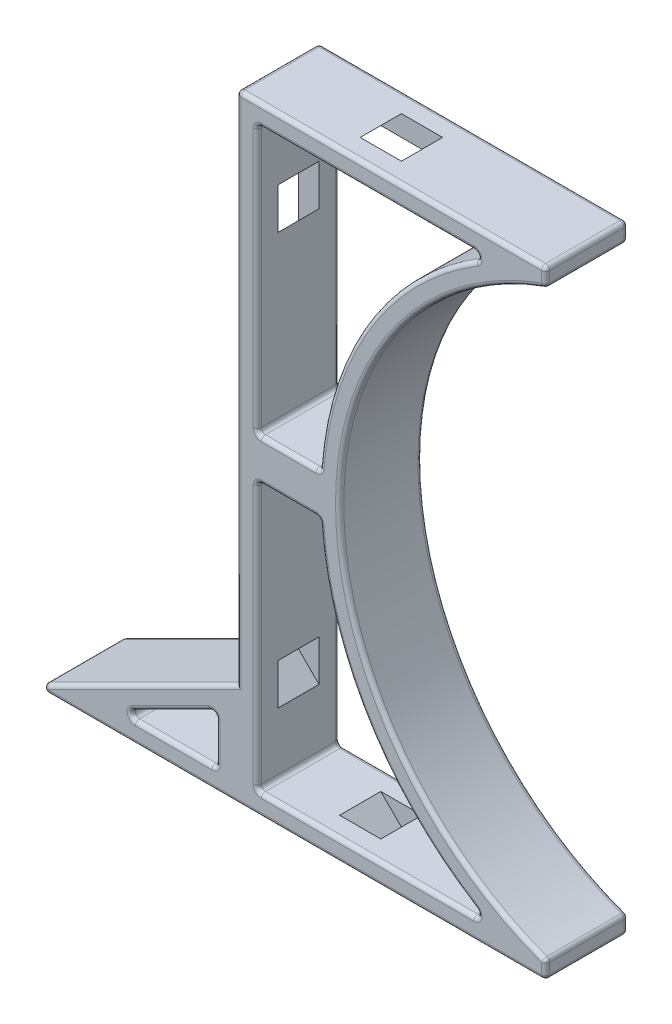
from build123d import *

# Parameters (mm, degrees)
BOSS_EXTRUDE1_DEPTH  = 2.54
CUT_EXTRUDE2_DEPTH   = 1.27
MIRROR3_COPY_1_DEPTH = 2.54
MIRROR3_COPY_2_DEPTH = 1.27
BOSS_EXTRUDE2_START  = -5.08
BOSS_EXTRUDE2_DEPTH  = 5.08
FILLET1_R            = 0.254
FILLET2_R            = 0.254


with BuildPart() as part:
    # Sketch1 → Boss-Extrude1 (new body)
    with BuildSketch(Plane.XY):
        with BuildLine():
            Line((-6.35, 19.050000000000004), (-25.4, 19.05))
            Line((-25.4, 19.05), (-25.399999999999995, 0))
            Line((-25.399999999999995, 0), (-19.049999999999997, 0))
            ThreePointArc((-19.049999999999997, 0), (-15.554259866673185, 10.998522628062371), (-6.35, 17.960512242138304))
            Line((-6.35, 17.960512242138304), (-6.35, 19.050000000000004))
        make_face()
        with BuildLine():
            Line((-24.129999999999995, 17.78), (-24.129999999999992, 1.27))
            Line((-24.129999999999992, 1.27), (-20.280273666792567, 1.27))
            ThreePointArc((-20.280273666792567, 1.27), (-17.173038634830498, 10.862280793950196), (-9.837377699366836, 17.780000000000005))
            Line((-9.837377699366836, 17.780000000000005), (-24.129999999999995, 17.78))
        make_face(mode=Mode.SUBTRACT)
    boss_extrude1 = extrude(amount=-BOSS_EXTRUDE1_DEPTH)

    # Mirror1: Boss-Extrude1 across plane
    add(boss_extrude1.mirror(Plane.ZX))

    # Sketch2 → Cut-Extrude2 (cut)
    with BuildSketch(Plane(origin=(0, 0, -2.54), x_dir=(-1, 0, 0), z_dir=(0, 0, -1))):
        Polygon((25.400000000000002, 10.159999999999998), (16.50999999999999, 19.050000000000004), (19.049999999999994, 19.050000000000004), (25.4, 12.700000000000001), align=None)
    cut_extrude2 = extrude(amount=-CUT_EXTRUDE2_DEPTH, mode=Mode.SUBTRACT)

    # Mirror2: Cut-Extrude2 across plane
    add(cut_extrude2.mirror(Plane.ZX), mode=Mode.SUBTRACT)

    # Mirror3: Boss-Extrude1, Cut-Extrude2 across plane
    add(boss_extrude1.mirror(Plane(origin=(-2.602e-14, 1.735e-14, -2.54), x_dir=(1, 0, 0), z_dir=(0, 0, -1))))
    add(cut_extrude2.mirror(Plane(origin=(-2.602e-14, 1.735e-14, -2.54), x_dir=(1, 0, 0), z_dir=(0, 0, -1))), mode=Mode.SUBTRACT)

    # Mirror3 copy 1 sketch → Mirror3 copy 1 (add)
    with BuildSketch(Plane(origin=(0, 0, -5.08), x_dir=(1, 0, 0), z_dir=(0, 0, -1))):
        with BuildLine():
            Line((-6.35, 19.050000000000004), (-25.4, 19.05))
            Line((-25.4, 19.05), (-25.399999999999995, 0))
            Line((-25.399999999999995, 0), (-19.049999999999997, 0))
            ThreePointArc((-19.049999999999997, 0), (-15.554259866673185, 10.998522628062371), (-6.35, 17.960512242138304))
            Line((-6.35, 17.960512242138304), (-6.35, 19.050000000000004))
        make_face()
        with BuildLine():
            Line((-24.129999999999995, 17.78), (-24.129999999999992, 1.27))
            Line((-24.129999999999992, 1.27), (-20.280273666792567, 1.27))
            ThreePointArc((-20.280273666792567, 1.27), (-17.173038634830498, 10.862280793950196), (-9.837377699366836, 17.780000000000005))
            Line((-9.837377699366836, 17.780000000000005), (-24.129999999999995, 17.78))
        make_face(mode=Mode.SUBTRACT)
    extrude(amount=-MIRROR3_COPY_1_DEPTH)

    # Mirror3 copy 2 sketch → Mirror3 copy 2 (cut)
    with BuildSketch(Plane(origin=(0, 0, -2.54), x_dir=(-1, 0, 0), z_dir=(0, 0, 1))):
        Polygon((25.400000000000002, 10.159999999999998), (16.50999999999999, 19.050000000000004), (19.049999999999994, 19.050000000000004), (25.4, 12.700000000000001), align=None)
    extrude(amount=-MIRROR3_COPY_2_DEPTH, mode=Mode.SUBTRACT)

    # Sketch4 → Boss-Extrude2 (add)
    with BuildSketch(Plane(origin=(0, 0, -5.08), x_dir=(-1, 0, 0), z_dir=(0, 0, -1)).offset(BOSS_EXTRUDE2_START)):
        Polygon((25.4, -19.05), (38.099999999999994, -19.05), (25.4, -12.700000000000001), align=None)
        Polygon((26.669999999999998, -17.78), (32.72019366857526, -17.78), (26.669999999999998, -14.754903165712367), align=None, mode=Mode.SUBTRACT)
    extrude(amount=BOSS_EXTRUDE2_DEPTH)

    # Fillet1
    fillet1_edges = [part.edges().sort_by_distance(p)[0] for p in [
        (-24.129999999999995, 17.78, -2.54),
        (-9.837377699366836, 17.780000000000005, -2.54),
        (-20.280273666792567, 1.27, -2.54),
        (-24.129999999999992, 1.27, -2.54),
        (-38.099999999999994, -19.05, -2.54),
        (-26.669999999999998, -17.78, -2.54),
        (-32.72019366857526, -17.78, -2.54),
        (-26.669999999999998, -14.754903165712367, -2.54),
        (-6.35, -17.960512242138307, -2.54),
        (-6.35, -19.050000000000004, -2.54),
        (-24.129999999999995, -17.78, -2.54),
        (-24.129999999999992, -1.27, -2.54),
        (-20.280273666792567, -1.27, -2.54),
        (-9.837377699366836, -17.780000000000005, -2.54),
        (-6.35, 17.960512242138307, -2.54),
        (-25.4, 19.05, -2.54),
        (-6.35, 19.050000000000004, -2.54),
    ]]
    fillet(fillet1_edges, radius=FILLET1_R)

    # Fillet2
    fillet2_edges = [part.edges().sort_by_distance(p)[0] for p in [
        (-31.268815493486017, -15.634407746743012, 0),
        (-15.875, 19.05, -5.08),
        (-15.875, 19.05, 0),
        (-24.129999999999995, 9.525, 0),
        (-17.32615367264149, 17.78, 0),
        (-17.35691828606442, 10.565973102884694, 0),
        (-22.196738957591226, 1.27, 0),
        (-6.35, 18.46761410424942, 0),
        (-25.4, 3.0479999999999983, 0),
        (-21.814019366857522, -19.050000000000004, 0),
        (-6.35, -18.4676141042494, 0),
        (-19.049999999999997, 1.332e-14, 0),
        (-17.32615367264149, -17.78, 0),
        (-24.129999999999995, -9.525, 0),
        (-22.196738957591226, -1.27, 0),
        (-17.35691828606442, -10.565973102884694, 0),
        (-29.28411620114516, -17.78, 0),
        (-29.39770845440215, -16.118757392913444, 0),
        (-26.669999999999998, -16.345941899427423, 0),
        (-37.27124397703985, -18.854357241819027, 0),
        (-6.395928782435079, -17.993549217490983, 0),
        (-6.424394877578617, -18.97560512242139, 0),
        (-6.424394877578616, 18.975605122421385, 0),
        (-6.395928782435086, 17.993549217491022, 0),
        (-25.325605122421383, 18.97560512242138, 0),
        (-25.4, 3.0479999999999983, -5.08),
        (-6.35, 18.46761410424942, -5.08),
        (-19.049999999999997, -1.332e-14, -5.08),
        (-6.35, -18.4676141042494, -5.08),
        (-21.814019366857522, -19.050000000000004, -5.08),
        (-31.268815493486017, -15.634407746743012, -5.08),
        (-17.32615367264149, 17.78, -5.08),
        (-24.129999999999995, 9.525, -5.08),
        (-22.196738957591226, 1.27, -5.08),
        (-17.35691828606442, 10.565973102884694, -5.08),
        (-24.129999999999995, -9.525, -5.08),
        (-17.32615367264149, -17.78, -5.08),
        (-17.35691828606442, -10.565973102884694, -5.08),
        (-22.196738957591226, -1.27, -5.08),
        (-26.669999999999998, -16.345941899427423, -5.08),
        (-29.39770845440215, -16.118757392913444, -5.08),
        (-29.28411620114516, -17.78, -5.08),
        (-37.27124397703985, -18.854357241819027, -5.08),
        (-6.39592878243508, -17.99354921749098, -5.08),
        (-6.424394877578617, -18.97560512242139, -5.08),
        (-6.424394877578616, 18.975605122421385, -5.08),
        (-6.395928782435085, 17.993549217491022, -5.08),
        (-25.325605122421383, 18.97560512242138, -5.08),
        (-10.531895731326044, 17.595130043851885, 0),
        (-10.531895731326044, 17.595130043851885, -5.08),
        (-24.055605122421376, 17.70560512242138, 0),
        (-24.055605122421376, 17.70560512242138, -5.08),
        (-20.34465280555276, 1.3378616603665934, 0),
        (-20.34465280555276, 1.3378616603665934, -5.08),
        (-24.055605122421372, 1.344394877578617, 0),
        (-24.055605122421372, 1.344394877578617, -5.08),
        (-20.34465280555276, -1.3378616603665934, 0),
        (-20.34465280555276, -1.3378616603665934, -5.08),
        (-24.055605122421372, -1.3443948775786172, 0),
        (-24.055605122421372, -1.3443948775786172, -5.08),
        (-10.531895731326044, -17.595130043851885, 0),
        (-10.531895731326044, -17.595130043851885, -5.08),
        (-24.055605122421376, -17.705605122421385, 0),
        (-24.055605122421376, -17.705605122421385, -5.08),
        (-26.79046429752174, -14.949818493533423, -5.08),
        (-26.79046429752174, -14.949818493533423, 0),
        (-26.744394877578614, -17.70560512242138, -5.08),
        (-26.744394877578614, -17.70560512242138, 0),
        (-31.89143764561512, -17.58435724181903, -5.08),
        (-31.89143764561512, -17.58435724181903, 0),
    ]]
    fillet(fillet2_edges, radius=FILLET2_R)


solid = part.part
